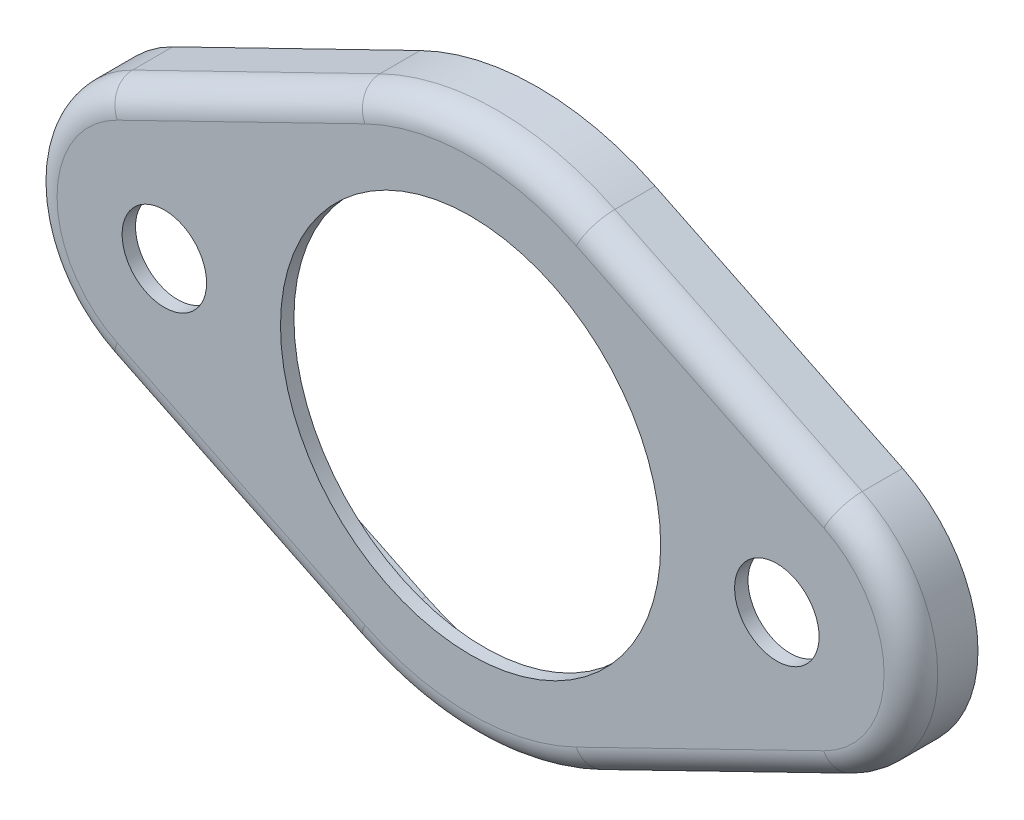
from build123d import *

# Parameters (mm, degrees)
SKETCH1_R           = 4
SKETCH1_R_2         = 18
BOSS_EXTRUDE1_DEPTH = 6.35
CUT_EXTRUDE1_DEPTH  = 5.08
FILLET1_R           = 2.54


with BuildPart() as part:
    # Sketch1 → Boss-Extrude1 (new body)
    with BuildSketch(Plane.XY):
        with BuildLine():
            Line((-34.561724138, 11.41740884), (-11.123448276, 22.834817679))
            ThreePointArc((-11.123448276, 22.834817679), (0, 25.4), (11.123448276, 22.834817679))
            Line((11.123448276, 22.834817679), (34.561724138, 11.41740884))
            ThreePointArc((34.561724138, 11.41740884), (41.7, 0), (34.561724138, -11.41740884))
            Line((34.561724138, -11.41740884), (11.123448276, -22.834817679))
            ThreePointArc((11.123448276, -22.834817679), (0, -25.4), (-11.123448276, -22.834817679))
            Line((-11.123448276, -22.834817679), (-34.561724138, -11.41740884))
            ThreePointArc((-34.561724138, -11.41740884), (-41.7, 0), (-34.561724138, 11.41740884))
        make_face()
        with Locations((-29, 0)):
            Circle(SKETCH1_R, mode=Mode.SUBTRACT)
        with Locations((29, 0)):
            Circle(SKETCH1_R, mode=Mode.SUBTRACT)
        Circle(SKETCH1_R_2, mode=Mode.SUBTRACT)
    extrude(amount=BOSS_EXTRUDE1_DEPTH)

    # Sketch2 → Cut-Extrude1 (cut)
    with BuildSketch(Plane(origin=(0, 0, 0), x_dir=(-1, 0, 0), z_dir=(0, 0, -1))):
        with BuildLine():
            Line((34.005551724, 10.275667956), (10.567275862, 21.693076795))
            ThreePointArc((10.567275862, 21.693076795), (0, 24.13), (-10.567275862, 21.693076795))
            Line((-10.567275862, 21.693076795), (-34.005551724, 10.275667956))
            ThreePointArc((-34.005551724, 10.275667956), (-40.43, 0), (-34.005551724, -10.275667956))
            Line((-34.005551724, -10.275667956), (-10.567275862, -21.693076795))
            ThreePointArc((-10.567275862, -21.693076795), (0, -24.13), (10.567275862, -21.693076795))
            Line((10.567275862, -21.693076795), (34.005551724, -10.275667956))
            ThreePointArc((34.005551724, -10.275667956), (40.43, 0), (34.005551724, 10.275667956))
        make_face()
    extrude(amount=-CUT_EXTRUDE1_DEPTH, mode=Mode.SUBTRACT)

    # Fillet1
    fillet1_edges = [part.edges().sort_by_distance(p)[0] for p in [
        (-41.7, 0, 6.35),
        (-22.842586207, -17.12611326, 6.35),
        (0, -25.4, 6.35),
        (22.842586207, -17.12611326, 6.35),
        (41.7, 0, 6.35),
        (22.842586207, 17.12611326, 6.35),
        (0, 25.4, 6.35),
        (0, 24.13, 5.08),
        (-22.286413793, 15.984372376, 5.08),
        (-40.43, 0, 5.08),
        (-22.286413793, -15.984372376, 5.08),
        (0, -24.13, 5.08),
        (22.286413793, -15.984372376, 5.08),
        (40.43, 0, 5.08),
        (22.286413793, 15.984372376, 5.08),
        (-22.842586207, 17.12611326, 6.35),
    ]]
    fillet(fillet1_edges, radius=FILLET1_R)


solid = part.part
